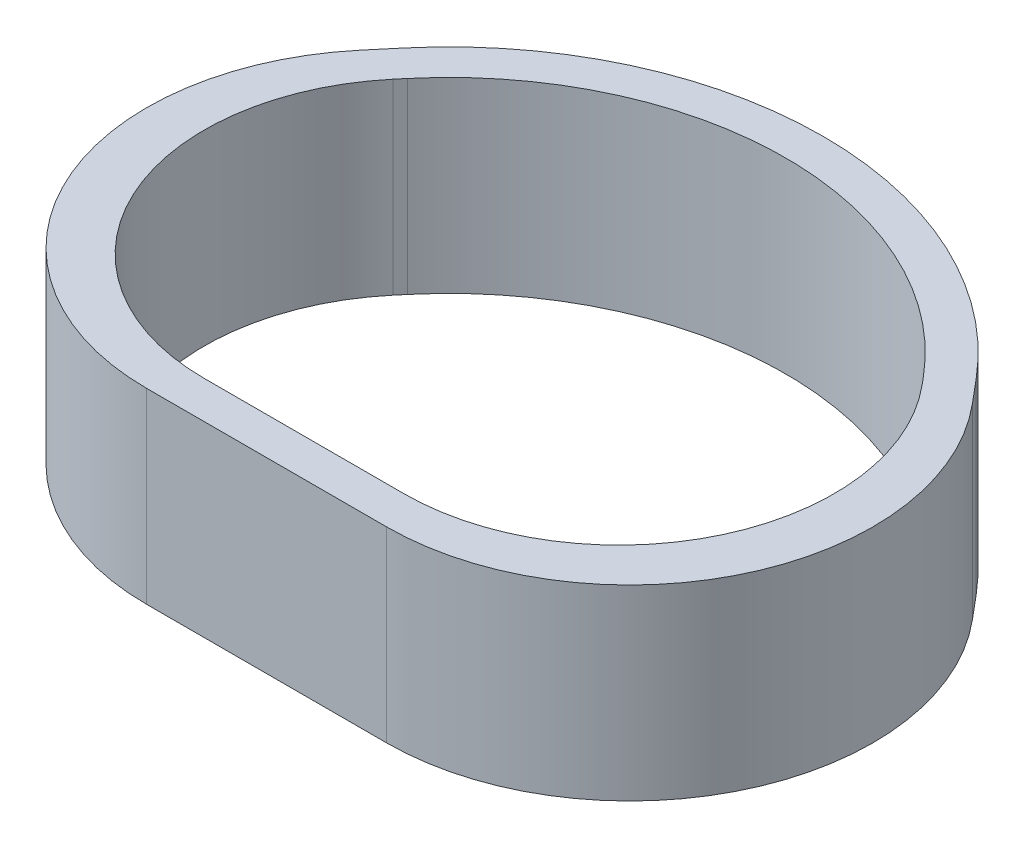
from build123d import *

# Parameters (mm, degrees)
EXTRUDE_1_DEPTH = 100


with BuildPart() as part:
    # 草图2 → 凸台-拉伸1 (new body)
    with BuildSketch(Plane(origin=(0, 0, 0), x_dir=(1, 0, 0), z_dir=(0, 1, 0))):
        with BuildLine():
            Line((153.208888624, 206.053310881), (163.690016349, 193.562389259))
            ThreePointArc((163.690016349, 193.562389259), (181.924251059, 55.059625974), (64.104238744, -20))
            Line((64.104238744, -20), (-64.104238744, -20))
            ThreePointArc((-64.104238744, -20), (-181.924251059, 55.059625974), (-163.690016349, 193.562389259))
            Line((-163.690016349, 193.562389259), (-153.208888624, 206.053310881))
            ThreePointArc((-153.208888624, 206.053310881), (0, 277.495788943), (153.208888624, 206.053310881))
        make_face()
        with BuildLine():
            Line((141.4768151, 188.920575114), (137.887999761, 193.197558687))
            ThreePointArc((137.887999761, 193.197558687), (0, 257.495788943), (-137.887999761, 193.197558687))
            Line((-137.887999761, 193.197558687), (-141.4768151, 188.920575114))
            ThreePointArc((-141.4768151, 188.920575114), (-157.607099651, 66.3988999), (-53.381704141, 0))
            Line((-53.381704141, 0), (53.381704141, 0))
            ThreePointArc((53.381704141, 0), (157.607099651, 66.3988999), (141.4768151, 188.920575114))
        make_face(mode=Mode.SUBTRACT)
    extrude(amount=EXTRUDE_1_DEPTH)


solid = part.part
